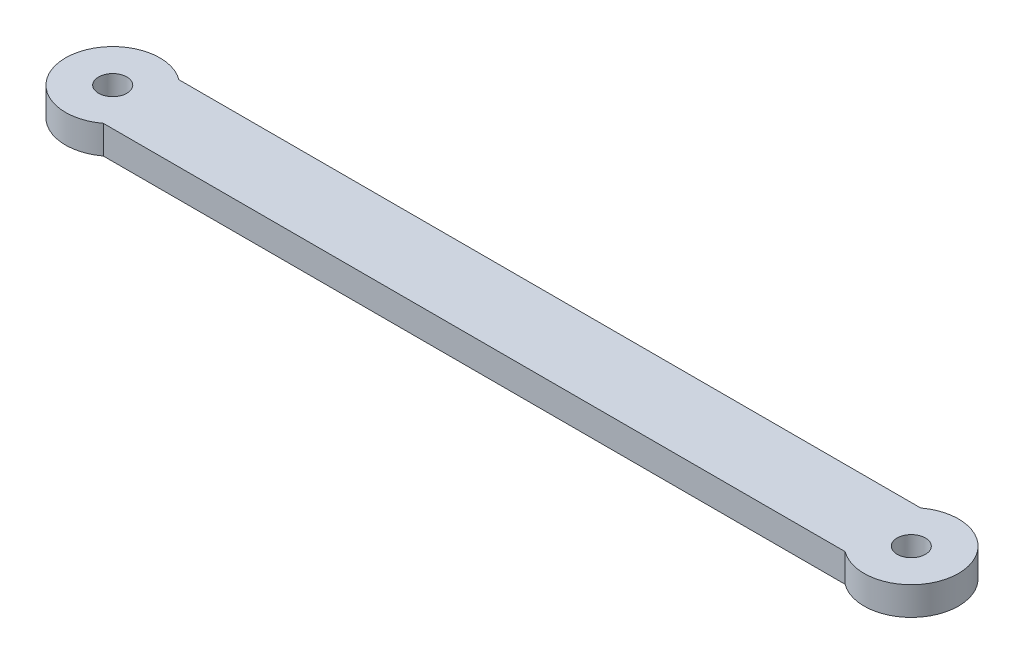
from build123d import *

# Parameters (mm, degrees)
CROQUIS1_R              = 1.5
SALIENTE_EXTRUIR1_DEPTH = 3


with BuildPart() as part:
    # Croquis1 → Saliente-Extruir1 (new body)
    with BuildSketch(Plane(origin=(0, 0, 0), x_dir=(1, 0, 0), z_dir=(0, 1, 0))):
        with BuildLine():
            Line((-39.26805, 4), (39.26805, 4))
            ThreePointArc((39.26805, 4), (47.26805, 0), (39.26805, -4))
            Line((39.26805, -4), (-39.26805, -4))
            ThreePointArc((-39.26805, -4), (-47.26805, 0), (-39.26805, 4))
        make_face()
        with Locations(Location((-42.26805, 0, 0), (0, 0, 270))):
            Circle(CROQUIS1_R, mode=Mode.SUBTRACT)
        with Locations(Location((42.26805, 0, 0), (0, 0, 90))):
            Circle(CROQUIS1_R, mode=Mode.SUBTRACT)
    extrude(amount=SALIENTE_EXTRUIR1_DEPTH)


solid = part.part
